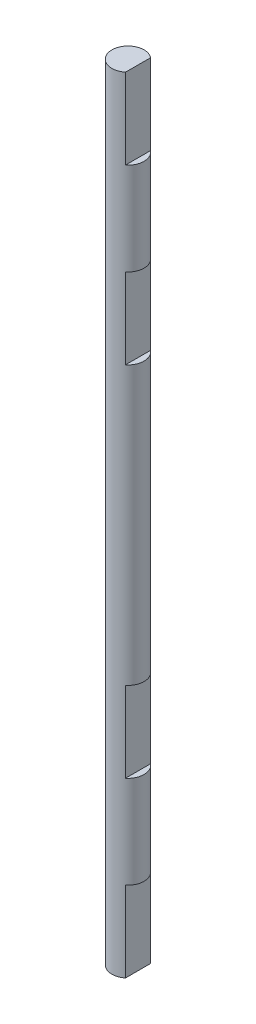
from build123d import *

# Parameters (mm, degrees)
SKETCH1_R                           = 4
BOSS_EXTRUDE1_DEPTH                 = 195
CUT_EXTRUDE1_REACH                  = 197.082
CUT_EXTRUDE1_END_RADIUS             = 4
SKETCH2_W                           = 1.5
SKETCH2_H                           = 20
CUT_EXTRUDE1_DIRECTION_2_REACH      = 197.082
CUT_EXTRUDE1_DIRECTION_2_END_RADIUS = 4


with BuildPart() as part:
    # Sketch1 → Boss-Extrude1 (new body)
    with BuildSketch(Plane(origin=(0, 0, 0), x_dir=(1, 0, 0), z_dir=(0, 1, 0))):
        with Locations(Location((0, 0, 0), (0, 0, 270))):
            Circle(SKETCH1_R)
    extrude(amount=BOSS_EXTRUDE1_DEPTH)

    # Cut-Extrude1: up to this cylinder (the profile starts inside it)
    cut_extrude1_end = Plane(origin=(0, 97.5, 0), z_dir=(0, -1, 0)) * Cylinder(CUT_EXTRUDE1_END_RADIUS, 578.164, mode=Mode.PRIVATE)
    # Sketch2 → Cut-Extrude1 (cut, up to the surface)
    with BuildSketch(Plane.XY, mode=Mode.PRIVATE) as cut_extrude1_sk1:
        with Locations((3.25, 185)):
            Rectangle(SKETCH2_W, SKETCH2_H)
    cut_extrude1_tool1 = extrude(cut_extrude1_sk1.sketch, amount=-CUT_EXTRUDE1_REACH, mode=Mode.PRIVATE) & cut_extrude1_end
    add(cut_extrude1_tool1.solids().sort_by_distance((3.25, 185, 0))[0], mode=Mode.SUBTRACT)
    # Sketch2 → Cut-Extrude1 (cut, up to the surface)
    with BuildSketch(Plane.XY, mode=Mode.PRIVATE) as cut_extrude1_sk2:
        with Locations((3.25, 142)):
            Rectangle(SKETCH2_W, SKETCH2_H)
    cut_extrude1_tool2 = extrude(cut_extrude1_sk2.sketch, amount=-CUT_EXTRUDE1_REACH, mode=Mode.PRIVATE) & cut_extrude1_end
    add(cut_extrude1_tool2.solids().sort_by_distance((3.25, 142, 0))[0], mode=Mode.SUBTRACT)
    # Sketch2 → Cut-Extrude1 (cut, up to the surface)
    with BuildSketch(Plane.XY, mode=Mode.PRIVATE) as cut_extrude1_sk3:
        with Locations((3.25, 53)):
            Rectangle(SKETCH2_W, SKETCH2_H)
    cut_extrude1_tool3 = extrude(cut_extrude1_sk3.sketch, amount=-CUT_EXTRUDE1_REACH, mode=Mode.PRIVATE) & cut_extrude1_end
    add(cut_extrude1_tool3.solids().sort_by_distance((3.25, 53, 0))[0], mode=Mode.SUBTRACT)
    # Sketch2 → Cut-Extrude1 (cut, up to the surface)
    with BuildSketch(Plane.XY, mode=Mode.PRIVATE) as cut_extrude1_sk4:
        with Locations((3.25, 10)):
            Rectangle(SKETCH2_W, SKETCH2_H)
    cut_extrude1_tool4 = extrude(cut_extrude1_sk4.sketch, amount=-CUT_EXTRUDE1_REACH, mode=Mode.PRIVATE) & cut_extrude1_end
    add(cut_extrude1_tool4.solids().sort_by_distance((3.25, 10, 0))[0], mode=Mode.SUBTRACT)

    # Cut-Extrude1 direction 2: up to this cylinder (the profile starts inside it)
    cut_extrude1_direction_2_end = Plane(origin=(0, 97.5, 0), z_dir=(0, -1, 0)) * Cylinder(CUT_EXTRUDE1_DIRECTION_2_END_RADIUS, 578.164, mode=Mode.PRIVATE)
    # Sketch2 → Cut-Extrude1 direction 2 (cut, up to the surface)
    with BuildSketch(Plane.XY, mode=Mode.PRIVATE) as cut_extrude1_direction_2_sk1:
        with Locations((3.25, 185)):
            Rectangle(SKETCH2_W, SKETCH2_H)
    cut_extrude1_direction_2_tool1 = extrude(cut_extrude1_direction_2_sk1.sketch, amount=CUT_EXTRUDE1_DIRECTION_2_REACH, mode=Mode.PRIVATE) & cut_extrude1_direction_2_end
    add(cut_extrude1_direction_2_tool1.solids().sort_by_distance((3.25, 185, 0))[0], mode=Mode.SUBTRACT)
    # Sketch2 → Cut-Extrude1 direction 2 (cut, up to the surface)
    with BuildSketch(Plane.XY, mode=Mode.PRIVATE) as cut_extrude1_direction_2_sk2:
        with Locations((3.25, 142)):
            Rectangle(SKETCH2_W, SKETCH2_H)
    cut_extrude1_direction_2_tool2 = extrude(cut_extrude1_direction_2_sk2.sketch, amount=CUT_EXTRUDE1_DIRECTION_2_REACH, mode=Mode.PRIVATE) & cut_extrude1_direction_2_end
    add(cut_extrude1_direction_2_tool2.solids().sort_by_distance((3.25, 142, 0))[0], mode=Mode.SUBTRACT)
    # Sketch2 → Cut-Extrude1 direction 2 (cut, up to the surface)
    with BuildSketch(Plane.XY, mode=Mode.PRIVATE) as cut_extrude1_direction_2_sk3:
        with Locations((3.25, 53)):
            Rectangle(SKETCH2_W, SKETCH2_H)
    cut_extrude1_direction_2_tool3 = extrude(cut_extrude1_direction_2_sk3.sketch, amount=CUT_EXTRUDE1_DIRECTION_2_REACH, mode=Mode.PRIVATE) & cut_extrude1_direction_2_end
    add(cut_extrude1_direction_2_tool3.solids().sort_by_distance((3.25, 53, 0))[0], mode=Mode.SUBTRACT)
    # Sketch2 → Cut-Extrude1 direction 2 (cut, up to the surface)
    with BuildSketch(Plane.XY, mode=Mode.PRIVATE) as cut_extrude1_direction_2_sk4:
        with Locations((3.25, 10)):
            Rectangle(SKETCH2_W, SKETCH2_H)
    cut_extrude1_direction_2_tool4 = extrude(cut_extrude1_direction_2_sk4.sketch, amount=CUT_EXTRUDE1_DIRECTION_2_REACH, mode=Mode.PRIVATE) & cut_extrude1_direction_2_end
    add(cut_extrude1_direction_2_tool4.solids().sort_by_distance((3.25, 10, 0))[0], mode=Mode.SUBTRACT)


solid = part.part
